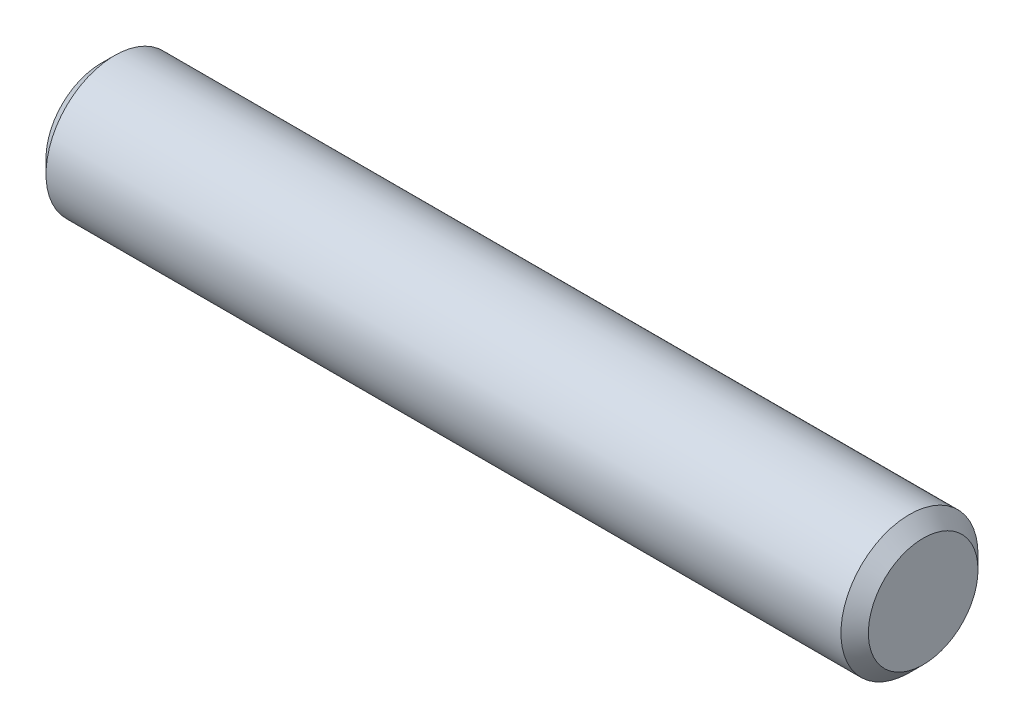
from build123d import *

# Parameters (mm, degrees)
EXTRUDE1_DEPTH      = 19.05
EXTRUDE1_DEPTH_BACK = 19.05
SKETCH2_R           = 3.175
CHAMFER1_SIZE       = 0.635


with BuildPart() as part:
    # Sketch2 → Extrude1 (new, two sides: drawn at the far end of the back side and taken through both)
    with BuildSketch(Plane(origin=(0, 0, 0), x_dir=(0, 0, -1), z_dir=(1, 0, 0)).offset(-EXTRUDE1_DEPTH_BACK)):
        Circle(SKETCH2_R)
    extrude(amount=EXTRUDE1_DEPTH + EXTRUDE1_DEPTH_BACK)

    # Chamfer1
    chamfer1_edges = [part.edges().sort_by_distance(p)[0] for p in [
        (-19.05, 0, 3.175),
        (19.05, 0, 3.175),
    ]]
    chamfer(chamfer1_edges, length=CHAMFER1_SIZE)


solid = part.part
